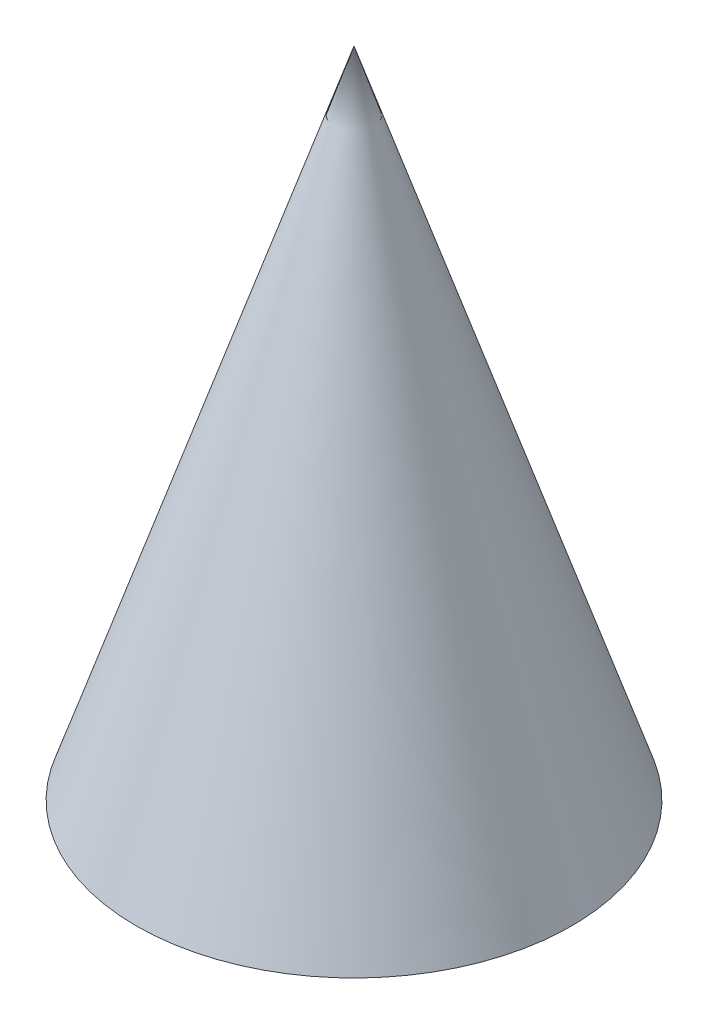
from build123d import *


with BuildPart() as part:
    # Sketch1 → Revolve1 (revolve)
    with BuildSketch(Plane.XY, mode=Mode.PRIVATE) as revolve1_sk:
        Polygon((0, 0), (0, 76.2), (25.4, 0), align=None)
    revolve(revolve1_sk.sketch.rotate(Axis((0, 0, 0), (0, 1, 0)), 90), axis=Axis((0, 0, 0), (0, 1, 0)))


solid = part.part
